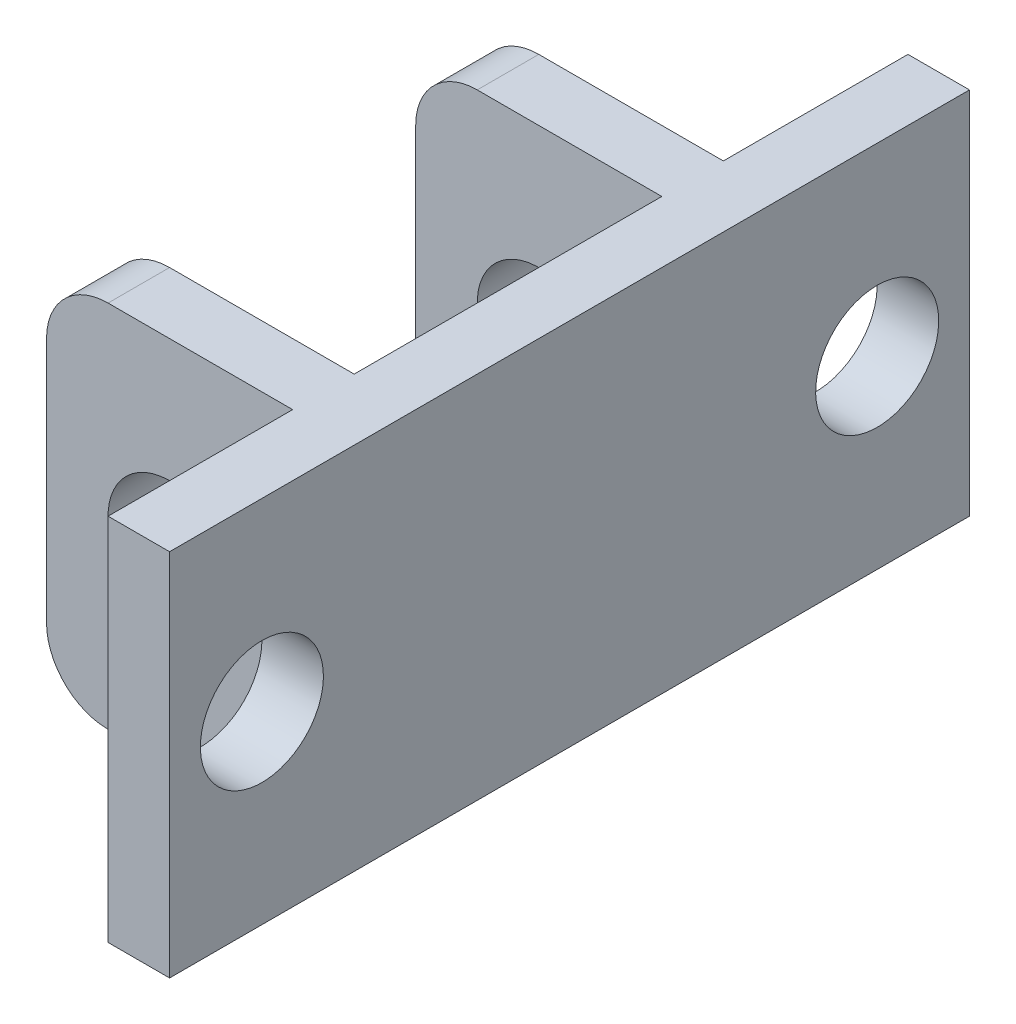
from build123d import *

# Parameters (mm, degrees)
SKETCH_1_W      = 4
SKETCH_1_H      = 6
SKETCH_1_R      = 1
EXTRUDE_1_DEPTH = 1
SKETCH_2_W      = 3
SKETCH_2_H      = 6
SKETCH_2_R      = 1
SKETCH_2_W_2    = 3.5
EXTRUDE_2_DEPTH = 1
FILLET_1_R      = 1


with BuildPart() as part:
    # 草图1 → 凸台-拉伸1 (new body)
    with BuildSketch(Plane.XY):
        Rectangle(SKETCH_1_W, SKETCH_1_H)
        Circle(SKETCH_1_R, mode=Mode.SUBTRACT)
    extrude(amount=EXTRUDE_1_DEPTH)

    # 草图2 → 凸台-拉伸2 (add)
    # profile 1 of 2: a face of its own
    with BuildSketch(Plane(origin=(2, 0, 0), x_dir=(0, 0, -1), z_dir=(1, 0, 0))):
        with Locations((-2.5, 0)):
            Rectangle(SKETCH_2_W, SKETCH_2_H)
        with Locations(Location((-2.5, 0, 0), (0, 0, 90))):
            Circle(SKETCH_2_R, mode=Mode.SUBTRACT)
    # profile 2 of 2: a face of its own
    with BuildSketch(Plane(origin=(2, 0, 0), x_dir=(0, 0, -1), z_dir=(1, 0, 0))):
        with Locations((0.75, 0)):
            Rectangle(SKETCH_2_W_2, SKETCH_2_H)
    extrude(amount=EXTRUDE_2_DEPTH)

    # 圆角1
    fillet_1_edges = [part.edges().sort_by_distance(p)[0] for p in [
        (-2, -3, 0.5),
        (-2, 3, 0.5),
    ]]
    fillet(fillet_1_edges, radius=FILLET_1_R)

    # 镜向1: part across plane


with BuildPart() as part_1:
    add(part.part)
    add(part.part.mirror(Plane(origin=(3, 0, -2.5), x_dir=(1, 0, 0), z_dir=(0, 0, 1))))


solid = part_1.part
